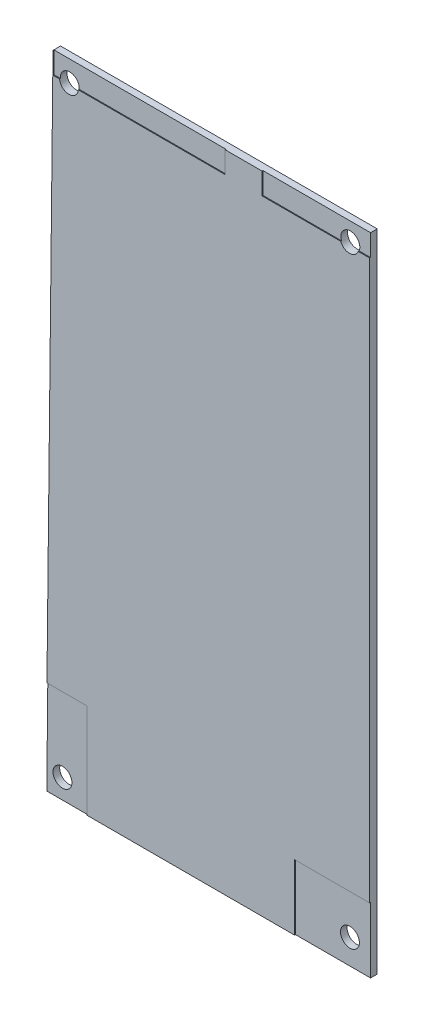
from build123d import *

# Parameters (mm, degrees)
SALIENTE_EXTRUIR1_DEPTH    = 1.75
CROQUIS2_W                 = 17.5
CROQUIS2_H                 = 15.2
CROQUIS2_W_2               = 9.5
CROQUIS2_H_2               = 22
CROQUIS2_W_3               = 40
CROQUIS2_H_3               = 5
CROQUIS2_W_4               = 25
CORTAR_EXTRUIR1_DEPTH      = 0.2
CORTAR_EXTRUIR2_DEPTH      = 168.824208623
CORTAR_EXTRUIR2_DEPTH_BACK = 168.824208623
CROQUIS3_R                 = 2.2


with BuildPart() as part:
    # Croquis1 → Saliente-Extruir1 (new body)
    with BuildSketch(Plane.XY):
        Polygon((0, 0), (75.25, 0), (75.25, 150), (1.65, 150), align=None)
    extrude(amount=SALIENTE_EXTRUIR1_DEPTH)

    # Croquis2 → Cortar-Extruir1 (cut)
    with BuildSketch(Plane.XY.offset(1.75)):
        with Locations((66.5, 7.6)):
            Rectangle(CROQUIS2_W, CROQUIS2_H)
        with Locations((4.75, 11)):
            Rectangle(CROQUIS2_W_2, CROQUIS2_H_2)
        with Locations((21.65, 147.5)):
            Rectangle(CROQUIS2_W_3, CROQUIS2_H_3)
        with Locations((62.75, 147.5)):
            Rectangle(CROQUIS2_W_4, CROQUIS2_H_3)
    extrude(amount=-CORTAR_EXTRUIR1_DEPTH, mode=Mode.SUBTRACT)

    # Croquis3 → Cortar-Extruir2 (cut, two sides: drawn at the far end of the back side and taken through both)
    with BuildSketch(Plane.XY.offset(1.55).offset(-CORTAR_EXTRUIR2_DEPTH_BACK)):
        with Locations((3.650817793, 4.6)):
            Circle(CROQUIS3_R)
        with Locations((70.45, 5.8)):
            Circle(CROQUIS3_R)
        with Locations((5.35, 145.2)):
            Circle(CROQUIS3_R)
        with Locations((70.55, 145.8)):
            Circle(CROQUIS3_R)
    extrude(amount=CORTAR_EXTRUIR2_DEPTH + CORTAR_EXTRUIR2_DEPTH_BACK, mode=Mode.SUBTRACT)


solid = part.part
